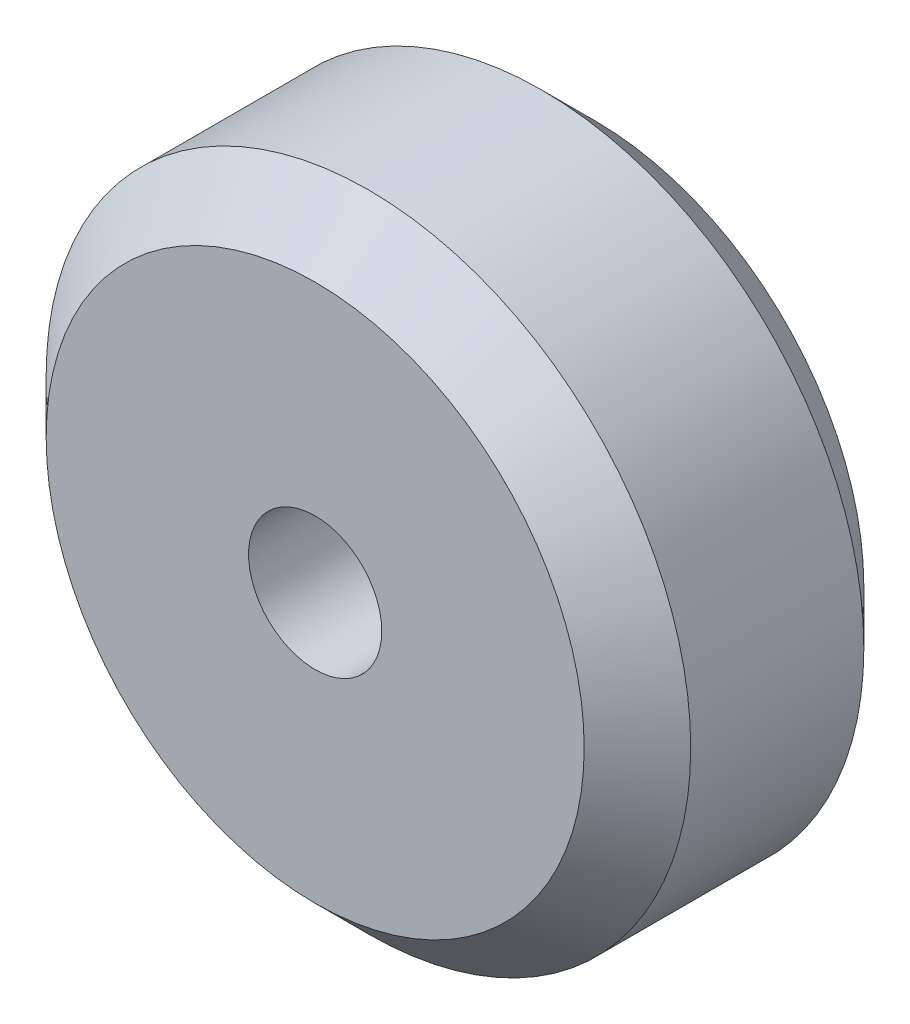
from build123d import *

# Parameters (mm, degrees)
SKETCH1_R           = 12.1
BOSS_EXTRUDE1_DEPTH = 10.5
SKETCH2_R           = 2.5
CUT_EXTRUDE1_DEPTH  = 21.076603298
CHAMFER1_SIZE       = 2


with BuildPart() as part:
    # Sketch1 → Boss-Extrude1 (new body)
    with BuildSketch(Plane.XY):
        with Locations(Location((0, 0, 0), (0, 0, 180))):
            Circle(SKETCH1_R)
    extrude(amount=BOSS_EXTRUDE1_DEPTH)

    # Sketch2 → Cut-Extrude1 (cut, through all)
    with BuildSketch(Plane.XY.offset(10.5)):
        Circle(SKETCH2_R)
    extrude(amount=-CUT_EXTRUDE1_DEPTH, mode=Mode.SUBTRACT)

    # Chamfer1
    chamfer1_edges = [part.edges().sort_by_distance(p)[0] for p in [
        (12.1, 0, 0),
        (12.1, 0, 10.5),
    ]]
    chamfer(chamfer1_edges, length=CHAMFER1_SIZE)


solid = part.part
